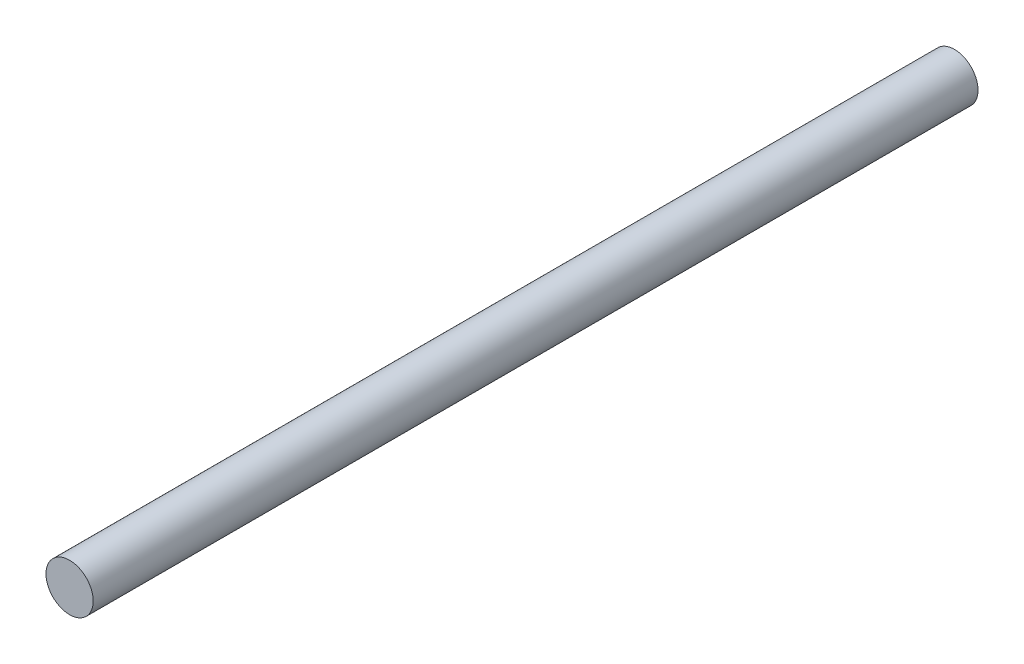
from build123d import *

# Parameters (mm, degrees)
SKETCH2_R           = 4
BOSS_EXTRUDE1_DEPTH = 75


with BuildPart() as part:
    # Sketch2 → Boss-Extrude1 (new, symmetric)
    with BuildSketch(Plane(origin=(0, 0, -54), x_dir=(-1, 0, 0), z_dir=(0, 0, -1))):
        Circle(SKETCH2_R)
    extrude(amount=BOSS_EXTRUDE1_DEPTH, both=True)


solid = part.part
